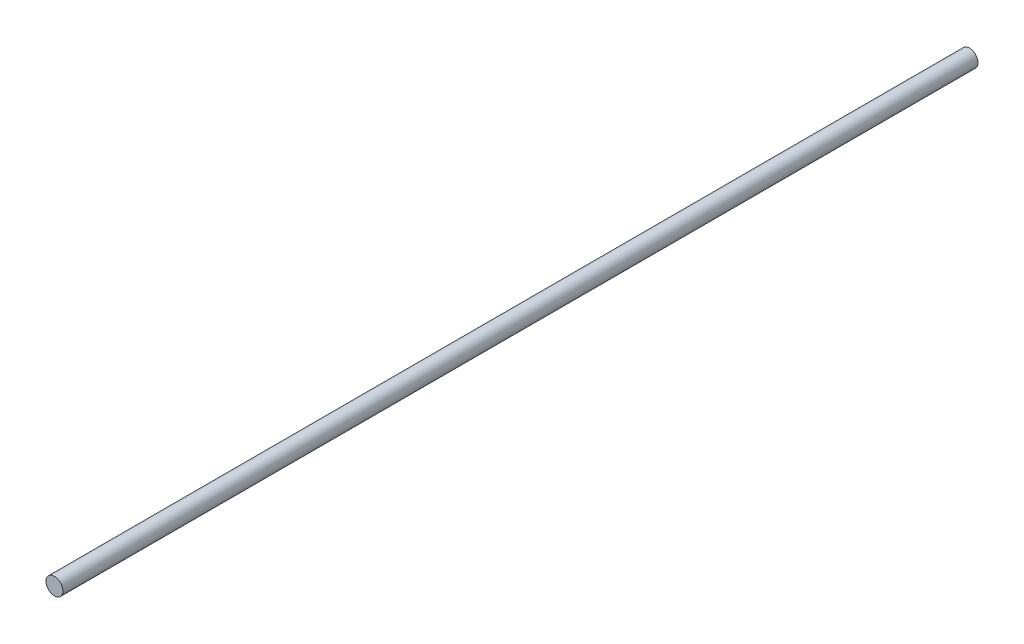
from build123d import *

# Parameters (mm, degrees)
SKETCH1_R           = 2.5
BOSS_EXTRUDE1_DEPTH = 270


with BuildPart() as part:
    # Sketch1 → Boss-Extrude1 (new body)
    with BuildSketch(Plane.XY):
        Circle(SKETCH1_R)
    extrude(amount=BOSS_EXTRUDE1_DEPTH)


solid = part.part
